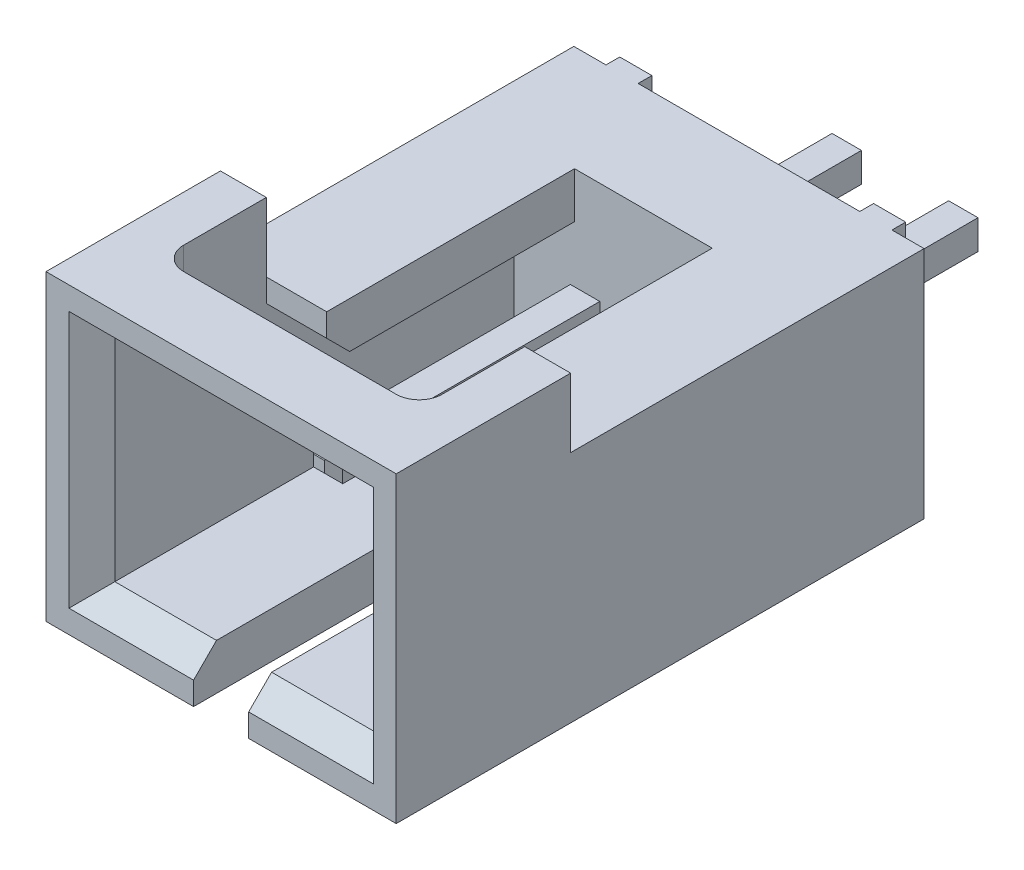
from build123d import *

# Parameters (mm, degrees)
EXTRUDE_1_DEPTH                    = 2.55
CUT_EXTRUDE_1_DEPTH                = 9.2
EXTRUDE_2_DEPTH                    = 3.8
SKETCH_4_W                         = 5.63
SKETCH_4_H                         = 1
CUT_EXTRUDE_2_DEPTH                = 3.8
CUT_EXTRUDE_3_REACH                = 16.048
CHAMFER_1_SIZE                     = 0.5
EXTRUDE_START                      = -3.6
SKETCH_6_W                         = 0.64
SKETCH_6_H                         = 0.64
EXTRUDE_3_DEPTH                    = 11.7
CHAMFER_2_SIZE                     = 0.2
PATTERN_LINEAR_1_COUNT             = 2
PATTERN_LINEAR_1_PITCH             = 2.54
CHAMFER_2_OF_PATTERN_LINEAR_1_SIZE = 0.2


with BuildPart() as part:
    # Эскиз1 → Бобышка-Вытянуть1 (new, symmetric)
    with BuildSketch(Plane(origin=(0, 0, 0), x_dir=(1, 0, 0), z_dir=(0, 1, 0))):
        Polygon((-2.415, -0.3), (2.415, -0.3), (2.415, 0), (3.115, 0), (3.115, -0.3), (3.815, -0.3), (3.815, -11.8), (-3.815, -11.8), (-3.815, -0.3), (-3.115, -0.3), (-3.115, 0), (-2.415, 0), align=None)
    extrude(amount=EXTRUDE_1_DEPTH, both=True)

    # Эскиз2 → Вырез-Вытянуть1 (cut)
    with BuildSketch(Plane.XY.offset(11.8)):
        Polygon((-2.815, 1.55), (-2.815, -1.55), (-0.6, -1.55), (-0.6, -2.55), (0.6, -2.55), (0.6, -1.55), (2.815, -1.55), (2.815, 1.55), (1.5, 1.55), (1.5, 2.55), (-1.5, 2.55), (-1.5, 1.55), align=None)
    extrude(amount=-CUT_EXTRUDE_1_DEPTH, mode=Mode.SUBTRACT)

    # Эскиз3 → Бобышка-Вытянуть2 (add)
    with BuildSketch(Plane.XY.offset(11.8)):
        Polygon((-3.815, 2.55), (-3.815, 4.05), (3.815, 4.05), (3.815, 2.55), (2.815, 2.55), (2.815, 3.05), (-2.815, 3.05), (-2.815, 2.55), align=None)
    extrude(amount=-EXTRUDE_2_DEPTH)

    # Эскиз4 → Вырез-Вытянуть2 (cut)
    with BuildSketch(Plane.XY.offset(11.8)):
        with Locations((0, 2.05)):
            Rectangle(SKETCH_4_W, SKETCH_4_H)
    extrude(amount=-CUT_EXTRUDE_2_DEPTH, mode=Mode.SUBTRACT)

    # Эскиз5 → Вырез-Вытянуть3 (cut, up to next)
    with BuildSketch(Plane(origin=(0, 4.05, 0), x_dir=(1, 0, 0), z_dir=(0, 1, 0)), mode=Mode.PRIVATE) as cut_extrude_3_sk1:
        with BuildLine():
            Line((2.815, -8), (2.815, -9.8))
            ThreePointArc((2.815, -9.8), (2.668553391, -10.153553391), (2.315, -10.3))
            Line((2.315, -10.3), (-2.315, -10.3))
            ThreePointArc((-2.315, -10.3), (-2.668553391, -10.153553391), (-2.815, -9.8))
            Line((-2.815, -9.8), (-2.815, -8))
            Line((-2.815, -8), (2.815, -8))
        make_face()
    cut_extrude_3_tool1 = extrude(cut_extrude_3_sk1.sketch, amount=-CUT_EXTRUDE_3_REACH, mode=Mode.PRIVATE) & part.part
    add(cut_extrude_3_tool1.solids().sort_by_distance((0, 4.05, 9.141324))[0], mode=Mode.SUBTRACT)

    # Фаска1
    chamfer_1_edges = [part.edges().sort_by_distance(p)[0] for p in [
        (-2.1575, 1.55, 8),
        (2.1575, 1.55, 8),
        (-2.815, 0.75, 11.8),
        (-1.7075, -1.55, 11.8),
        (1.7075, -1.55, 11.8),
        (2.815, 0.75, 11.8),
        (0, 3.05, 11.8),
    ]]
    chamfer(chamfer_1_edges, length=CHAMFER_1_SIZE)

    # Эскиз6 → Бобышка-Вытянуть3 (add)
    with BuildSketch(Plane.XY.offset(0.3).offset(EXTRUDE_START)):
        with Locations((1.27, 0)):
            Rectangle(SKETCH_6_W, SKETCH_6_H)
    extrude_3 = extrude(amount=EXTRUDE_3_DEPTH)

    # Фаска2
    chamfer_2_edges = [part.edges().sort_by_distance(p)[0] for p in [
        (1.27, 0.32, 8.4),
        (1.59, 0, 8.4),
        (1.27, -0.32, 8.4),
        (0.95, 0, 8.4),
        (0.95, 0, -3.3),
        (1.27, 0.32, -3.3),
        (1.59, 0, -3.3),
        (1.27, -0.32, -3.3),
    ]]
    chamfer(chamfer_2_edges, length=CHAMFER_2_SIZE)

    # Линейный массив1: Бобышка-Вытянуть3 ×2
    with Locations(*[(-i * PATTERN_LINEAR_1_PITCH, 0, 0) for i in range(1, PATTERN_LINEAR_1_COUNT)]):
        add(extrude_3)

    # Фаска2 of Линейный массив1
    chamfer_2_of_pattern_linear_1_edges = [part.edges().sort_by_distance(p)[0] for p in [
        (-1.27, 0.32, 8.4),
        (-0.95, 0, 8.4),
        (-1.27, -0.32, 8.4),
        (-1.59, 0, 8.4),
        (-1.59, 0, -3.3),
        (-1.27, 0.32, -3.3),
        (-0.95, 0, -3.3),
        (-1.27, -0.32, -3.3),
    ]]
    chamfer(chamfer_2_of_pattern_linear_1_edges, length=CHAMFER_2_OF_PATTERN_LINEAR_1_SIZE)


solid = part.part
